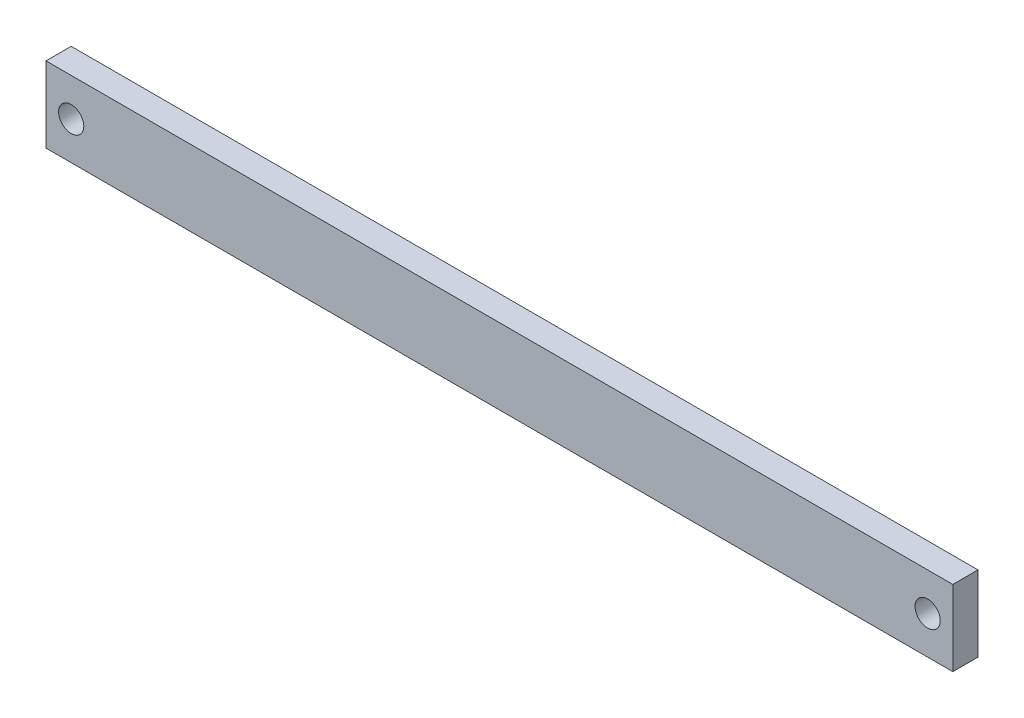
from build123d import *

# Parameters (mm, degrees)
SKETCH1_W           = 180
SKETCH1_H           = 15
SKETCH1_R           = 2.5
BOSS_EXTRUDE1_DEPTH = 5


with BuildPart() as part:
    # Sketch1 → Boss-Extrude1 (new body)
    with BuildSketch(Plane.XY):
        Rectangle(SKETCH1_W, SKETCH1_H)
        with Locations((85, 0)):
            Circle(SKETCH1_R, mode=Mode.SUBTRACT)
        with Locations((-85, 0)):
            Circle(SKETCH1_R, mode=Mode.SUBTRACT)
    extrude(amount=BOSS_EXTRUDE1_DEPTH)


solid = part.part
